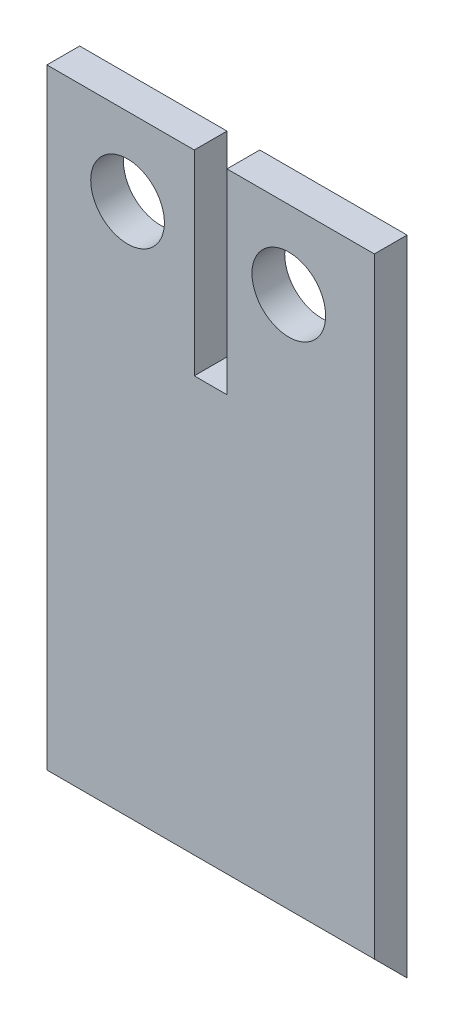
from build123d import *

# Parameters (mm, degrees)
EXTRUDE_1_DEPTH         = 20
SKETCH_2_W              = 2
SKETCH_2_H              = 11.94849378
CUT_EXTRUDE_1_DEPTH     = 28.333766513
HOLE_WIZARD_4_5_4_5_1_D = 4.5


with BuildPart() as part:
    # 草图1 → 凸台-拉伸1 (new body)
    with BuildSketch(Plane(origin=(12.274514863, 0, 0), x_dir=(0, 0, -1), z_dir=(1, 0, 0))):
        Polygon((-3.657385812, -22.340728762), (-1.657385812, -24.340728762), (-1.657385812, 14.96095029), (-3.657385812, 14.96095029), align=None)
    extrude(amount=-EXTRUDE_1_DEPTH)

    # 草图2 → 切除-拉伸1 (cut, through all)
    with BuildSketch(Plane(origin=(0, 0, 1.657385812), x_dir=(-1, 0, 0), z_dir=(0, 0, -1))):
        with Locations((-2.274514863, 8.9867034)):
            Rectangle(SKETCH_2_W, SKETCH_2_H)
    extrude(amount=-CUT_EXTRUDE_1_DEPTH, mode=Mode.SUBTRACT)

    # Ø4.5 (4.5) 直径孔1 (through all)
    with Locations(Plane(origin=(0, 0, 1.657385812), x_dir=(-1, 0, 0), z_dir=(0, 0, -1))):
        with Locations((2.800485137, 10.199804672), (-7.049514863, 10.199804672)):
            Hole(HOLE_WIZARD_4_5_4_5_1_D / 2)


solid = part.part
